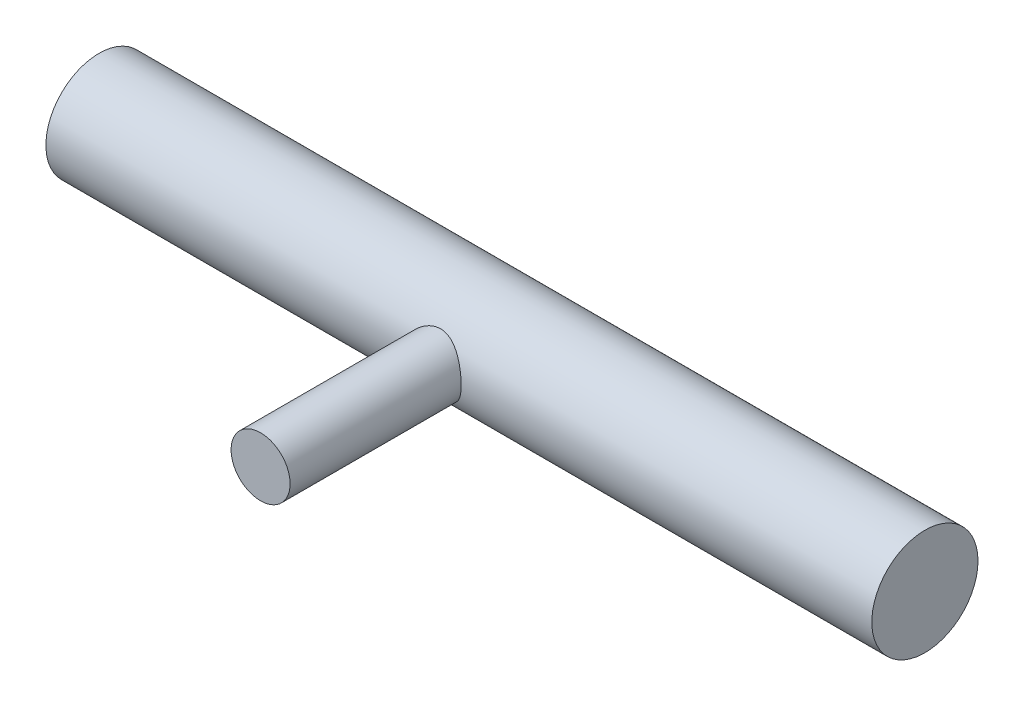
from build123d import *

# Parameters (mm, degrees)
SKETCH1_R                = 4.5
BOSS_EXTRUDE1_DEPTH      = 70
BOSS_EXTRUDE2_DEPTH      = 15
BOSS_EXTRUDE2_DEPTH_BACK = 3
SKETCH2_R                = 2.5


with BuildPart() as part:
    # Sketch1 → Boss-Extrude1 (new body)
    with BuildSketch(Plane(origin=(0, 0, 0), x_dir=(0, 0, -1), z_dir=(1, 0, 0))):
        Circle(SKETCH1_R)
    extrude(amount=BOSS_EXTRUDE1_DEPTH)

    # Sketch2 → Boss-Extrude2 (add, two sides: drawn at the far end of the back side and taken through both)
    with BuildSketch(Plane.XY.offset(4).offset(-BOSS_EXTRUDE2_DEPTH_BACK)):
        with Locations((32.696692571, 0)):
            Circle(SKETCH2_R)
    extrude(amount=BOSS_EXTRUDE2_DEPTH + BOSS_EXTRUDE2_DEPTH_BACK)


solid = part.part
